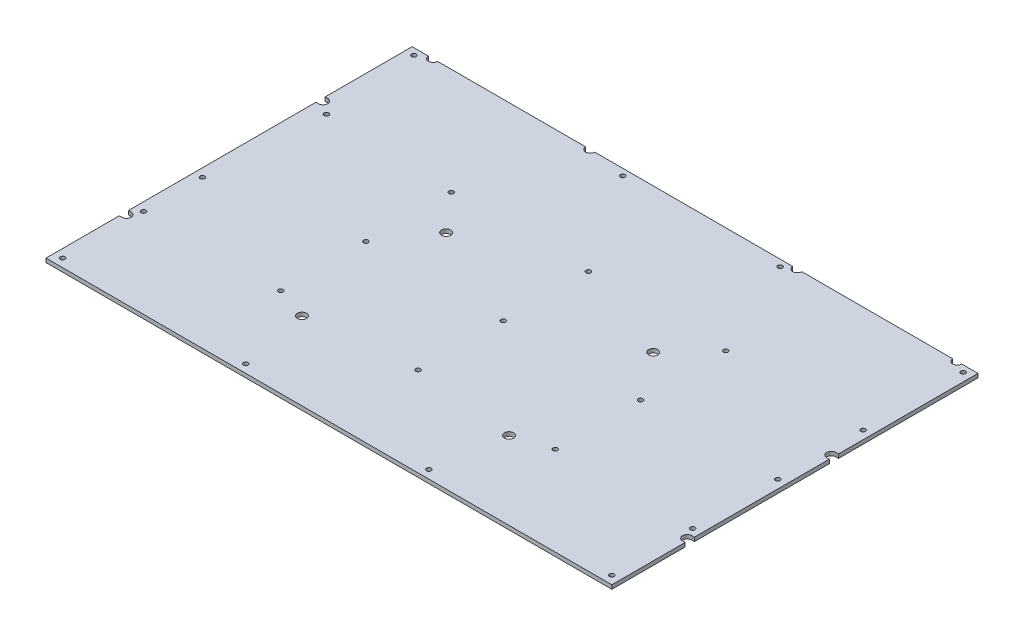
from build123d import *

# Parameters (mm, degrees)
SKETCH1_W            = 431.8
SKETCH1_H            = 294.7
BOSS_EXTRUDE1_DEPTH  = 3
SKETCH2_R            = 1.775
CUT_EXTRUDE1_DEPTH   = 262.407407125
LPATTERN1_COUNT      = 4
LPATTERN1_PITCH      = 139.7
SKETCH3_R            = 1.775
CUT_EXTRUDE2_DEPTH   = 262.407407125
LPATTERN2_COUNT      = 5
LPATTERN2_PITCH      = 104.77
LPATTERN2_COUNT_DIR2 = 3
LPATTERN2_PITCH_DIR2 = 65
SKETCH4_R            = 1.775
CUT_EXTRUDE3_DEPTH   = 10
SKETCH7_R            = 3.5
CUT_EXTRUDE5_DEPTH   = 262.407407125
SKETCH8_W            = 2
SKETCH8_H            = 7
CUT_EXTRUDE6_DEPTH   = 262.407407125
SKETCH9_W            = 431.8
SKETCH9_H            = 15.3
CUT_EXTRUDE7_DEPTH   = 262.407407125
SKETCH11_R           = 1.775
BOSS_EXTRUDE3_DEPTH  = 3
SKETCH12_R           = 1.775
CUT_EXTRUDE8_DEPTH   = 262.407407125


with BuildPart() as part:
    # Sketch1 → Boss-Extrude1 (new body)
    with BuildSketch(Plane(origin=(0, 0, 0), x_dir=(1, 0, 0), z_dir=(0, 1, 0))):
        Rectangle(SKETCH1_W, SKETCH1_H)
    extrude(amount=BOSS_EXTRUDE1_DEPTH)

    # Sketch2 → Cut-Extrude1 (cut, through all)
    with BuildSketch(Plane(origin=(0, 3, 0), x_dir=(1, 0, 0), z_dir=(0, 1, 0))):
        with Locations(Location((-209.55, -125.7, 0), (0, 0, 270))):
            Circle(SKETCH2_R)
        with Locations(Location((-209.55, 142.35, 0), (0, 0, 270))):
            Circle(SKETCH2_R)
    cut_extrude1 = extrude(amount=-CUT_EXTRUDE1_DEPTH, mode=Mode.SUBTRACT)

    # LPattern1: Cut-Extrude1 ×4
    with Locations(*[(i * LPATTERN1_PITCH, 0, 0) for i in range(1, LPATTERN1_COUNT)]):
        add(cut_extrude1, mode=Mode.SUBTRACT)

    # Sketch3 → Cut-Extrude2 (cut, through all)
    with BuildSketch(Plane(origin=(0, 3, 0), x_dir=(1, 0, 0), z_dir=(0, 1, 0))):
        with Locations(Location((-209.55, -64, 0), (0, 0, 270))):
            Circle(SKETCH3_R)
    cut_extrude2 = extrude(amount=-CUT_EXTRUDE2_DEPTH, mode=Mode.SUBTRACT)

    # LPattern2: Cut-Extrude2 5 × 3, 2 skipped
    with Locations(*[(i * LPATTERN2_PITCH, 0, -j * LPATTERN2_PITCH_DIR2) for i in range(LPATTERN2_COUNT) for j in range(LPATTERN2_COUNT_DIR2) if (i, j) not in ((0, 0), (0, 1), (0, 2))]):
        add(cut_extrude2, mode=Mode.SUBTRACT)

    # Sketch4 → Cut-Extrude3 (cut)
    with BuildSketch(Plane(origin=(0, 3, 0), x_dir=(1, 0, 0), z_dir=(0, 1, 0))):
        with Locations(Location((-203.9, 70, 0), (0, 0, 270))):
            Circle(SKETCH4_R)
        with Locations(Location((-209.55, -19, 0), (0, 0, 270))):
            Circle(SKETCH4_R)
    extrude(amount=-CUT_EXTRUDE3_DEPTH, mode=Mode.SUBTRACT)

    # Sketch7 → Cut-Extrude5 (cut, through all)
    with BuildSketch(Plane.XZ):
        with Locations((-213.9, -77.46)):
            Circle(SKETCH7_R)
        with Locations((-213.9, 72.58)):
            Circle(SKETCH7_R)
        with Locations((213.9, 72.58)):
            Circle(SKETCH7_R)
        with Locations((213.9, -37.42)):
            Circle(SKETCH7_R)
        with Locations((200, -147.42)):
            Circle(SKETCH7_R)
        with Locations((78, -147.42)):
            Circle(SKETCH7_R)
        with Locations((-80, -147.42)):
            Circle(SKETCH7_R)
        with Locations(Location((-80, -37.42, 0), (0, 0, 270))):
            Circle(SKETCH7_R)
        with Locations(Location((78, -37.42, 0), (0, 0, 270))):
            Circle(SKETCH7_R)
        with Locations(Location((78, 72.58, 0), (0, 0, 270))):
            Circle(SKETCH7_R)
        with Locations(Location((-80, 72.58, 0), (0, 0, 270))):
            Circle(SKETCH7_R)
        with Locations((-200, -147.42)):
            Circle(SKETCH7_R)
    extrude(amount=-CUT_EXTRUDE5_DEPTH, mode=Mode.SUBTRACT)

    # Sketch8 → Cut-Extrude6 (cut, through all)
    with BuildSketch(Plane(origin=(0, 3, 0), x_dir=(1, 0, 0), z_dir=(0, 1, 0))):
        with Locations((214.9, 37.42)):
            Rectangle(SKETCH8_W, SKETCH8_H)
        with Locations((214.9, -72.58)):
            Rectangle(SKETCH8_W, SKETCH8_H)
        with Locations((-214.9, 77.46)):
            Rectangle(SKETCH8_W, SKETCH8_H)
        with Locations((-214.9, -72.58)):
            Rectangle(SKETCH8_W, SKETCH8_H)
    extrude(amount=-CUT_EXTRUDE6_DEPTH, mode=Mode.SUBTRACT)

    # Sketch9 → Cut-Extrude7 (cut, through all)
    with BuildSketch(Plane.XZ):
        with Locations((0, 139.7)):
            Rectangle(SKETCH9_W, SKETCH9_H)
    extrude(amount=-CUT_EXTRUDE7_DEPTH, mode=Mode.SUBTRACT)

    # Sketch11 → Boss-Extrude3 (add)
    with BuildSketch(Plane(origin=(0, 3, 0), x_dir=(1, 0, 0), z_dir=(0, 1, 0))):
        with Locations((-69.85, 142.35)):
            Circle(SKETCH11_R)
    extrude(amount=-BOSS_EXTRUDE3_DEPTH)

    # Sketch12 → Cut-Extrude8 (cut, through all)
    with BuildSketch(Plane(origin=(0, 3, 0), x_dir=(1, 0, 0), z_dir=(0, 1, 0))):
        with Locations(Location((-50.15, 142.35, 0), (0, 0, 270))):
            Circle(SKETCH12_R)
    extrude(amount=-CUT_EXTRUDE8_DEPTH, mode=Mode.SUBTRACT)


solid = part.part
